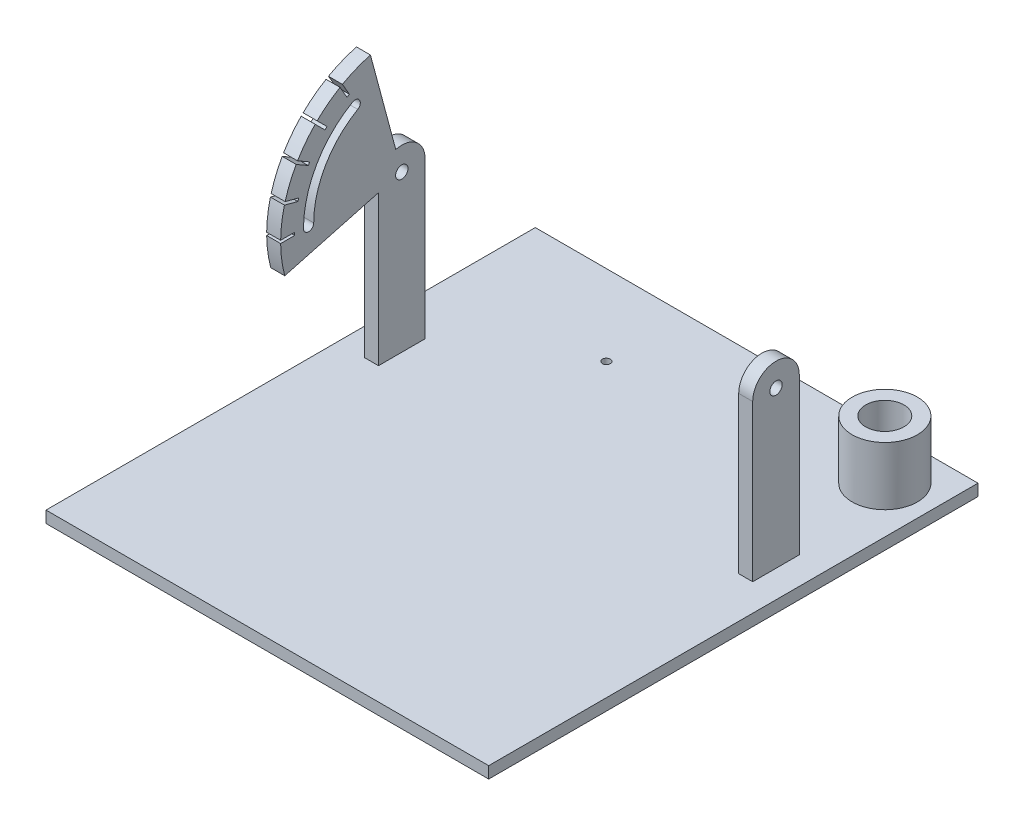
from build123d import *

# Parameters (mm, degrees)
CROQUIS_BASE_W               = 190
CROQUIS_BASE_H               = 210
PLACA_BASE_DEPTH             = 5
AGUJEROS_CAJA_DEPTH          = 166.151445649
AGUJEROS_CAJA_DEPTH_BACK     = 166.151445649
CROQUIS_TORNILLOS_CAJA_R     = 1.7
CROQUIS_ZOCALO_R             = 14
ZOCALO_MASTIL_DEPTH          = 25
CROQUIS_ZOCALO_HUECO_R       = 8.2
ZOCALO_HUECO_DEPTH           = 22
TORRE_DERECHA_DEPTH          = 6
TORRE_IZQUIERDA_START        = -6
TORRE_IZQUIERDA_DEPTH        = 6
ABANICO_DEPTH                = 6
RANURA_ARCO_DEPTH            = 206.401360592
RANURA_ARCO_DEPTH_BACK       = 206.401360592
MARCAS_ANGULO_DEPTH          = 206.401360592
MARCAS_ANGULO_DEPTH_BACK     = 206.401360592
CROQUIS_MARCAS_15_W          = 6.5
CROQUIS_MARCAS_15_H          = 1.2
AGUJERO_PIVOTE_M5_DEPTH      = 206.401360592
AGUJERO_PIVOTE_M5_DEPTH_BACK = 206.401360592
CROQUIS_PIVOTE_R             = 2.65


with BuildPart() as part:
    # Croquis_base → Placa_base (new body)
    with BuildSketch(Plane(origin=(0, 0, 0), x_dir=(1, 0, 0), z_dir=(0, 1, 0))):
        with Locations((0, -30)):
            Rectangle(CROQUIS_BASE_W, CROQUIS_BASE_H)
    extrude(amount=PLACA_BASE_DEPTH)

    # Croquis_tornillos_caja → Agujeros_caja (cut, two sides: drawn at the far end of the back side and taken through both)
    with BuildSketch(Plane(origin=(0, 0, 0), x_dir=(1, 0, 0), z_dir=(0, 1, 0)).offset(-AGUJEROS_CAJA_DEPTH_BACK)):
        with Locations(Location((-30, 40.5, 0), (0, 0, 90))):
            Circle(CROQUIS_TORNILLOS_CAJA_R)
        with Locations(Location((30, 40.5, 0), (0, 0, 90))):
            Circle(CROQUIS_TORNILLOS_CAJA_R)
    extrude(amount=AGUJEROS_CAJA_DEPTH + AGUJEROS_CAJA_DEPTH_BACK, mode=Mode.SUBTRACT)

    # Croquis_zocalo → Zocalo_mastil (add)
    with BuildSketch(Plane(origin=(0, 5, 0), x_dir=(1, 0, 0), z_dir=(0, 1, 0))):
        with Locations(Location((75, 55, 0), (0, 0, 90))):
            Circle(CROQUIS_ZOCALO_R)
    extrude(amount=ZOCALO_MASTIL_DEPTH)

    # Croquis_zocalo_hueco → Zocalo_hueco (cut)
    with BuildSketch(Plane(origin=(0, 30, 0), x_dir=(1, 0, 0), z_dir=(0, 1, 0))):
        with Locations(Location((75, 55, 0), (0, 0, 270))):
            Circle(CROQUIS_ZOCALO_HUECO_R)
    extrude(amount=-ZOCALO_HUECO_DEPTH, mode=Mode.SUBTRACT)

    # Croquis_torre_der → Torre_derecha (add)
    with BuildSketch(Plane(origin=(77.3, 0, 0), x_dir=(0, 0, -1), z_dir=(1, 0, 0))):
        with BuildLine():
            Line((-10, 0), (10, 0))
            Line((10, 0), (10, 72))
            ThreePointArc((10, 72), (0, 82), (-10, 72))
            Line((-10, 72), (-10, 0))
        make_face()
    extrude(amount=TORRE_DERECHA_DEPTH)

    # Croquis_torre_izq → Torre_izquierda (add)
    with BuildSketch(Plane(origin=(-77.3, 0, 0), x_dir=(0, 0, -1), z_dir=(1, 0, 0)).offset(TORRE_IZQUIERDA_START)):
        with BuildLine():
            Line((-10, 0), (10, 0))
            Line((10, 0), (10, 72))
            ThreePointArc((10, 72), (0, 82), (-10, 72))
            Line((-10, 72), (-10, 0))
        make_face()
    extrude(amount=TORRE_IZQUIERDA_DEPTH)

    # Croquis_abanico → Abanico (add)
    with BuildSketch(Plane(origin=(-77.3, 0, 0), x_dir=(0, 0, -1), z_dir=(1, 0, 0))):
        with BuildLine():
            Line((0, 72), (-13.458590345, 122.228142967))
            ThreePointArc((-13.458590345, 122.228142967), (-45.033320997, 98), (-50.228142967, 58.541409655))
            Line((-50.228142967, 58.541409655), (0, 72))
        make_face()
    extrude(amount=-ABANICO_DEPTH)

    # Croquis_ranura_arco → Ranura_arco (cut, two sides: drawn at the far end of the back side and taken through both)
    with BuildSketch(Plane(origin=(0, 0, 0), x_dir=(0, 0, -1), z_dir=(1, 0, 0)).offset(-RANURA_ARCO_DEPTH_BACK)):
        with BuildLine():
            ThreePointArc((-21.1, 108.54627204), (-36.54627204, 93.1), (-42.2, 72))
            ThreePointArc((-42.2, 72), (-40, 69.8), (-37.8, 72))
            ThreePointArc((-37.8, 72), (-32.735760263, 90.9), (-18.9, 104.735760263))
            ThreePointArc((-18.9, 104.735760263), (-18.094744112, 107.741016151), (-21.1, 108.54627204))
        make_face()
    extrude(amount=RANURA_ARCO_DEPTH + RANURA_ARCO_DEPTH_BACK, mode=Mode.SUBTRACT)

    # Croquis_marcas_15 → Marcas_angulo (cut, two sides: drawn at the far end of the back side and taken through both)
    with BuildSketch(Plane(origin=(0, 0, 0), x_dir=(0, 0, -1), z_dir=(1, 0, 0)).offset(-MARCAS_ANGULO_DEPTH_BACK)):
        with Locations((-49.25, 72)):
            Rectangle(CROQUIS_MARCAS_15_W, CROQUIS_MARCAS_15_H)
        Polygon((-44.587879436, 83.326120579), (-50.866397307, 85.008444372), (-50.555814453, 86.167555364), (-44.277296582, 84.48523157), align=None)
        Polygon((-40.137168574, 94.480384758), (-45.766333699, 97.730384758), (-45.166333699, 98.769615242), (-39.537168574, 95.519615242), align=None)
        Polygon((-32.951176003, 104.102647866), (-37.547370081, 108.698841944), (-36.698841944, 109.547370081), (-32.102647866, 104.951176003), align=None)
        Polygon((-23.519615242, 111.537168574), (-26.769615242, 117.166333699), (-25.730384758, 117.766333699), (-22.480384758, 112.137168574), align=None)
    extrude(amount=MARCAS_ANGULO_DEPTH + MARCAS_ANGULO_DEPTH_BACK, mode=Mode.SUBTRACT)

    # Croquis_pivote → Agujero_pivote_M5 (cut, two sides: drawn at the far end of the back side and taken through both)
    with BuildSketch(Plane(origin=(0, 0, 0), x_dir=(0, 0, -1), z_dir=(1, 0, 0)).offset(-AGUJERO_PIVOTE_M5_DEPTH_BACK)):
        with Locations((0, 72)):
            Circle(CROQUIS_PIVOTE_R)
    extrude(amount=AGUJERO_PIVOTE_M5_DEPTH + AGUJERO_PIVOTE_M5_DEPTH_BACK, mode=Mode.SUBTRACT)


solid = part.part
